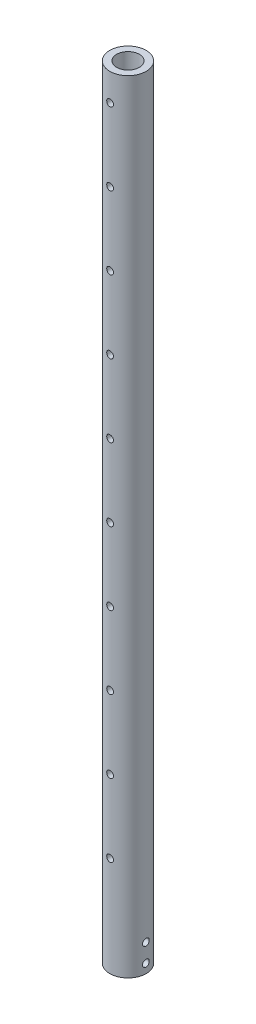
from build123d import *

# Parameters (mm, degrees)
SKETCH1_R           = 25.4
SKETCH1_R_2         = 15.875
BOSS_EXTRUDE1_DEPTH = 1092.2
CUT_EXTRUDE3_DEPTH  = 5.08
SKETCH11_R          = 4.7625
CUT_EXTRUDE8_DEPTH  = 35.814
SKETCH12_R          = 4.7625
CUT_EXTRUDE9_DEPTH  = 35.814
SKETCH16_R          = 4.7625
CUT_EXTRUDE10_DEPTH = 63.5


with BuildPart() as part:
    # Sketch1 → Boss-Extrude1 (new body)
    with BuildSketch(Plane(origin=(0, 0, 0), x_dir=(1, 0, 0), z_dir=(0, 1, 0))):
        with Locations(Location((0, 0, 0), (0, 0, 270))):
            Circle(SKETCH1_R)
        with Locations(Location((0, 0, 0), (0, 0, 270))):
            Circle(SKETCH1_R_2, mode=Mode.SUBTRACT)
    extrude(amount=BOSS_EXTRUDE1_DEPTH)

    # Sketch5 → Cut-Extrude3 (cut)
    with BuildSketch(Plane.XZ):
        with BuildLine():
            Line((-20.9422761, -0.95712788), (-20.322794931, -0.95712788))
            add(Edge.make_bspline(
                [(-20.322794931, -0.95712788), (-20.292470525, -0.957287311), (-20.233694281, -0.957596328), (-20.148223787, -0.962388882), (-20.068169509, -0.96892364), (-19.99350823, -0.979292367), (-19.92427445, -0.991803479), (-19.860259522, -1.006954412), (-19.801667008, -1.025121412), (-19.73171474, -1.054010538), (-19.651958141, -1.096939412), (-19.565599599, -1.160374611), (-19.491754325, -1.237964774), (-19.428085308, -1.325488325), (-19.377465721, -1.421768633), (-19.340845001, -1.524510897), (-19.317660357, -1.632389906), (-19.315275992, -1.706451931), (-19.314070972, -1.743881687)],
                knots=[0, 0, 0, 0, 1.001505555, 1.941167018, 2.826882275, 3.653841531, 4.429895133, 5.150066043, 5.825578002, 6.45369114, 7.647487171, 8.808567382, 9.977351308, 11.170798116, 12.373658725, 13.556498008, 14.765093433, 16, 16, 16, 16], degree=3))
            add(Edge.make_bspline(
                [(-19.314070972, -1.743881687), (-19.315062678, -1.778945076), (-19.317011472, -1.847847944), (-19.335646689, -1.948626172), (-19.36482101, -2.044557634), (-19.405375057, -2.135292227), (-19.458081868, -2.218779862), (-19.5205462, -2.295694024), (-19.595908728, -2.362778198), (-19.652372239, -2.400282116), (-19.681053144, -2.419332408)],
                knots=[0, 0, 0, 0, 1.044552857, 2.05264487, 3.044412934, 4.028983338, 5.005914585, 5.980388656, 6.974128949, 8, 8, 8, 8], degree=3))
            add(Edge.make_bspline(
                [(-19.681053144, -2.419332408), (-19.644984756, -2.433179942), (-19.575976995, -2.459673707), (-19.481011827, -2.506514449), (-19.399192217, -2.557461506), (-19.329889092, -2.613098256), (-19.270618505, -2.673068392), (-19.218863336, -2.738251245), (-19.174702376, -2.809497119), (-19.136862795, -2.886063183), (-19.107336423, -2.967167622), (-19.085223996, -3.052049683), (-19.072553524, -3.140404994), (-19.07075045, -3.200535302), (-19.069840203, -3.230890901)],
                knots=[0, 0, 0, 0, 1.27268992, 2.434971085, 3.483601985, 4.442670788, 5.356604649, 6.2567628, 7.179492994, 8.113709626, 9.066344395, 10.018646069, 10.999752585, 12, 12, 12, 12], degree=3))
            add(Edge.make_bspline(
                [(-19.069840203, -3.230890901), (-19.070726342, -3.261885135), (-19.072469845, -3.322867159), (-19.085333105, -3.412452174), (-19.107112795, -3.498063733), (-19.137113049, -3.580255577), (-19.176267435, -3.658868699), (-19.223917802, -3.73399216), (-19.280733578, -3.80487116), (-19.344290609, -3.872293304), (-19.416192698, -3.932915654), (-19.493767704, -3.986904902), (-19.57799258, -4.031305972), (-19.667484032, -4.068604078), (-19.763245947, -4.097094893), (-19.864848313, -4.117027157), (-19.972203501, -4.13045744), (-20.045872346, -4.131561619), (-20.083652302, -4.13212788)],
                knots=[0, 0, 0, 0, 0.978564426, 1.925352924, 2.850884081, 3.763762016, 4.682927383, 5.618979971, 6.567305752, 7.547517671, 8.540179244, 9.531824382, 10.526200242, 11.540722885, 12.589160233, 13.674978461, 14.80764778, 16, 16, 16, 16], degree=3))
            Line((-20.083652302, -4.13212788), (-20.9422761, -4.13212788))
            Line((-20.9422761, -4.13212788), (-20.9422761, -0.95712788))
        make_face()
        with BuildLine():
            Line((-20.657340203, -1.282768906), (-20.657340203, -2.300397111))
            Line((-20.657340203, -2.300397111), (-20.465898897, -2.300397111))
            add(Edge.make_bspline(
                [(-20.465898897, -2.300397111), (-20.437914633, -2.300034324), (-20.383843331, -2.299333345), (-20.305538853, -2.297325369), (-20.232854015, -2.291702858), (-20.165914281, -2.286081963), (-20.104825064, -2.276942873), (-20.049721704, -2.266064304), (-19.999739405, -2.254559097), (-19.94209996, -2.234992491), (-19.8767195, -2.206074886), (-19.807020898, -2.161196863), (-19.745576058, -2.107744057), (-19.693690038, -2.046066542), (-19.651225347, -1.978152216), (-19.621730762, -1.905084689), (-19.601730726, -1.828684998), (-19.599924123, -1.776235583), (-19.59900687, -1.749605845)],
                knots=[0, 0, 0, 0, 1.156816544, 2.235205308, 3.236616184, 4.169592532, 5.011045266, 5.787822928, 6.49130361, 7.128639758, 8.301311294, 9.436451833, 10.541879658, 11.654887649, 12.756523258, 13.837046038, 14.901820046, 16, 16, 16, 16], degree=3))
            add(Edge.make_bspline(
                [(-19.59900687, -1.749605845), (-19.59948419, -1.731983895), (-19.600420507, -1.697416516), (-19.60808886, -1.647025317), (-19.621122302, -1.59963277), (-19.637862983, -1.554589398), (-19.661257007, -1.513303648), (-19.688801006, -1.474348035), (-19.722080168, -1.439049185), (-19.759960016, -1.406056854), (-19.803510695, -1.376806461), (-19.852706224, -1.351188054), (-19.908212189, -1.330558921), (-19.969093136, -1.312492126), (-20.036286194, -1.299802745), (-20.109015967, -1.289231458), (-20.187878176, -1.283849613), (-20.242438377, -1.283137177), (-20.270641485, -1.282768906)],
                knots=[0, 0, 0, 0, 0.91205012, 1.789085906, 2.630437955, 3.453916878, 4.269457761, 5.079663411, 5.91843418, 6.774407191, 7.675494373, 8.627863946, 9.638891023, 10.736472738, 11.911756761, 13.175263542, 14.539845004, 16, 16, 16, 16], degree=3))
            Line((-20.270641485, -1.282768906), (-20.657340203, -1.282768906))
        make_face(mode=Mode.SUBTRACT)
        with BuildLine():
            Line((-20.657340203, -2.626038137), (-20.657340203, -3.806486855))
            Line((-20.657340203, -3.806486855), (-20.251560956, -3.806486855))
            add(Edge.make_bspline(
                [(-20.251560956, -3.806486855), (-20.222515216, -3.806138741), (-20.166533382, -3.805467798), (-20.085705837, -3.803277452), (-20.010791164, -3.798295173), (-19.942131213, -3.790452152), (-19.878984588, -3.781944559), (-19.822108814, -3.770504326), (-19.771042846, -3.757397055), (-19.711829724, -3.73713677), (-19.645151542, -3.705662114), (-19.573295979, -3.658205637), (-19.509409338, -3.601669494), (-19.455157425, -3.53623645), (-19.410695642, -3.465088032), (-19.378351051, -3.389663322), (-19.358402202, -3.311208593), (-19.355987234, -3.257717361), (-19.3547761, -3.230890901)],
                knots=[0, 0, 0, 0, 1.160039823, 2.235823828, 3.228722157, 4.157150951, 4.99529583, 5.772374946, 6.472645482, 7.099169577, 8.269452708, 9.405989375, 10.527446681, 11.663510218, 12.788923519, 13.866172445, 14.929861265, 16, 16, 16, 16], degree=3))
            add(Edge.make_bspline(
                [(-19.3547761, -3.230890901), (-19.355026567, -3.2141148), (-19.355523459, -3.180833196), (-19.363017016, -3.131923846), (-19.373915313, -3.084547518), (-19.388004542, -3.038575568), (-19.40852363, -2.994839148), (-19.432478139, -2.952473254), (-19.460564553, -2.911421884), (-19.504328903, -2.859522197), (-19.567984918, -2.799726049), (-19.658433207, -2.741181315), (-19.761278077, -2.693966519), (-19.83587016, -2.673919136), (-19.874402503, -2.663563177)],
                knots=[0, 0, 0, 0, 0.723448775, 1.435228256, 2.130040452, 2.821711965, 3.505591119, 4.210454504, 4.921174351, 5.648778258, 7.137944449, 8.670945889, 10.280296675, 12, 12, 12, 12], degree=3))
            add(Edge.make_bspline(
                [(-19.874402503, -2.663563177), (-19.889850325, -2.660428922), (-19.923344391, -2.653633211), (-19.977961268, -2.646459795), (-20.04031452, -2.640068919), (-20.11054813, -2.635341655), (-20.188750958, -2.63045529), (-20.27509002, -2.628554988), (-20.369212726, -2.626287802), (-20.434520093, -2.626123488), (-20.468442967, -2.626038137)],
                knots=[0, 0, 0, 0, 0.634451884, 1.375622551, 2.216452059, 3.157844607, 4.20941857, 5.370758133, 6.634282058, 8, 8, 8, 8], degree=3))
            Line((-20.468442967, -2.626038137), (-20.657340203, -2.626038137))
        make_face(mode=Mode.SUBTRACT)
    extrude(amount=-CUT_EXTRUDE3_DEPTH, mode=Mode.SUBTRACT)

    # Sketch11 → Cut-Extrude8 (cut, symmetric)
    with BuildSketch(Plane(origin=(0, 0, 0), x_dir=(0, 0, -1), z_dir=(1, 0, 0))):
        with Locations((0, 38.1)):
            Circle(SKETCH11_R)
    extrude(amount=CUT_EXTRUDE8_DEPTH, both=True, mode=Mode.SUBTRACT)

    # Sketch12 → Cut-Extrude9 (cut, symmetric)
    with BuildSketch(Plane(origin=(0, 0, 0), x_dir=(0, 0, -1), z_dir=(1, 0, 0))):
        with Locations((0, 12.7)):
            Circle(SKETCH12_R)
    extrude(amount=CUT_EXTRUDE9_DEPTH, both=True, mode=Mode.SUBTRACT)

    # Sketch16 → Cut-Extrude10 (cut, symmetric)
    with BuildSketch(Plane.XY):
        with Locations((0, 139.7)):
            Circle(SKETCH16_R)
        with Locations((0, 241.3)):
            Circle(SKETCH16_R)
        with Locations((0, 342.9)):
            Circle(SKETCH16_R)
        with Locations((0, 444.5)):
            Circle(SKETCH16_R)
        with Locations((0, 546.1)):
            Circle(SKETCH16_R)
        with Locations((0, 647.7)):
            Circle(SKETCH16_R)
        with Locations((0, 749.3)):
            Circle(SKETCH16_R)
        with Locations((0, 850.9)):
            Circle(SKETCH16_R)
        with Locations((0, 952.5)):
            Circle(SKETCH16_R)
        with Locations((0, 1054.1)):
            Circle(SKETCH16_R)
    extrude(amount=CUT_EXTRUDE10_DEPTH, both=True, mode=Mode.SUBTRACT)


solid = part.part
